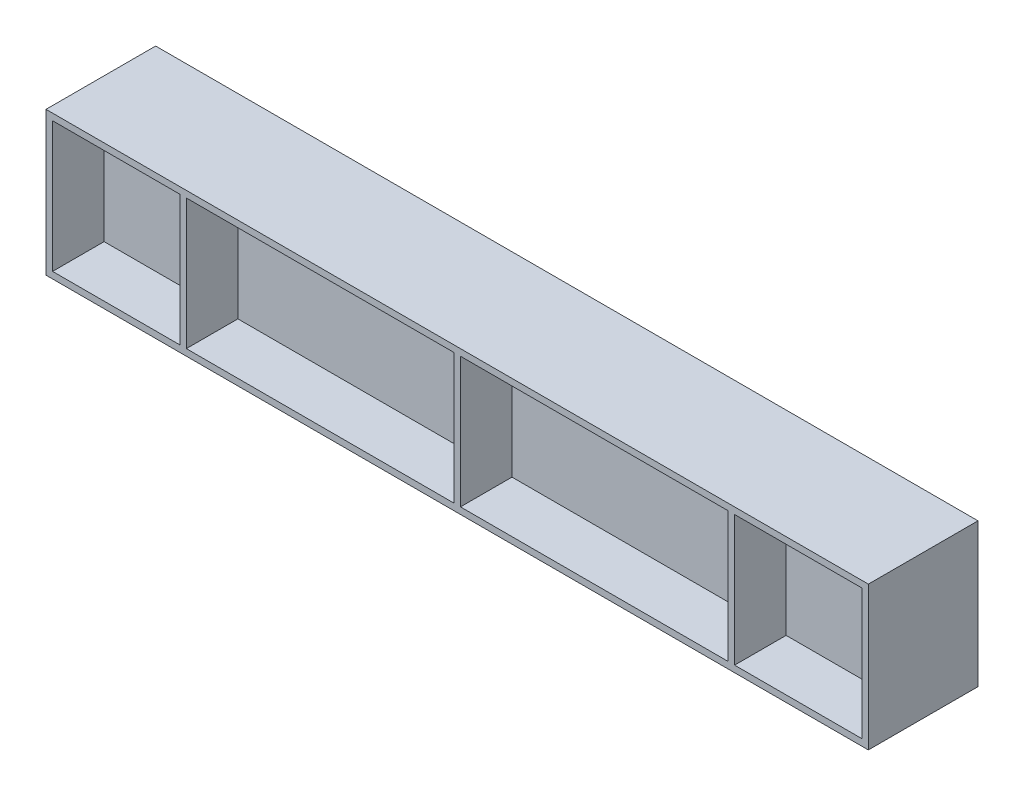
from build123d import *

# Parameters (mm, degrees)
SKETCH_1_W           = 1500
SKETCH_1_H           = 262
EXTRUDE_1_DEPTH      = 200
SKETCH_5_W           = 232
SKETCH_5_H           = 238
SKETCH_5_W_2         = 488
CUT_EXTRUDE_10_DEPTH = 1536.787745751
SKETCH_7_W           = 1500
SKETCH_7_H           = 12
EXTRUDE_13_DEPTH     = 260


with BuildPart() as part:
    # 草图1 → 拉伸1 (new body)
    with BuildSketch(Plane.XY):
        with Locations((750, 131)):
            Rectangle(SKETCH_1_W, SKETCH_1_H)
    extrude(amount=EXTRUDE_1_DEPTH)

    # 草图5 → 拉伸10 (cut, through all)
    with BuildSketch(Plane.XY.offset(200)):
        with Locations((128, 131)):
            Rectangle(SKETCH_5_W, SKETCH_5_H)
        with Locations((500, 131)):
            Rectangle(SKETCH_5_W_2, SKETCH_5_H)
        with Locations((1000, 131)):
            Rectangle(SKETCH_5_W_2, SKETCH_5_H)
        with Locations((1372, 131)):
            Rectangle(SKETCH_5_W, SKETCH_5_H)
    extrude(amount=-CUT_EXTRUDE_10_DEPTH, mode=Mode.SUBTRACT)

    # 草图7 → 拉伸13 (add)
    with BuildSketch(Plane.XZ):
        with Locations((750, 100)):
            Rectangle(SKETCH_7_W, SKETCH_7_H)
    extrude(amount=-EXTRUDE_13_DEPTH)


solid = part.part
